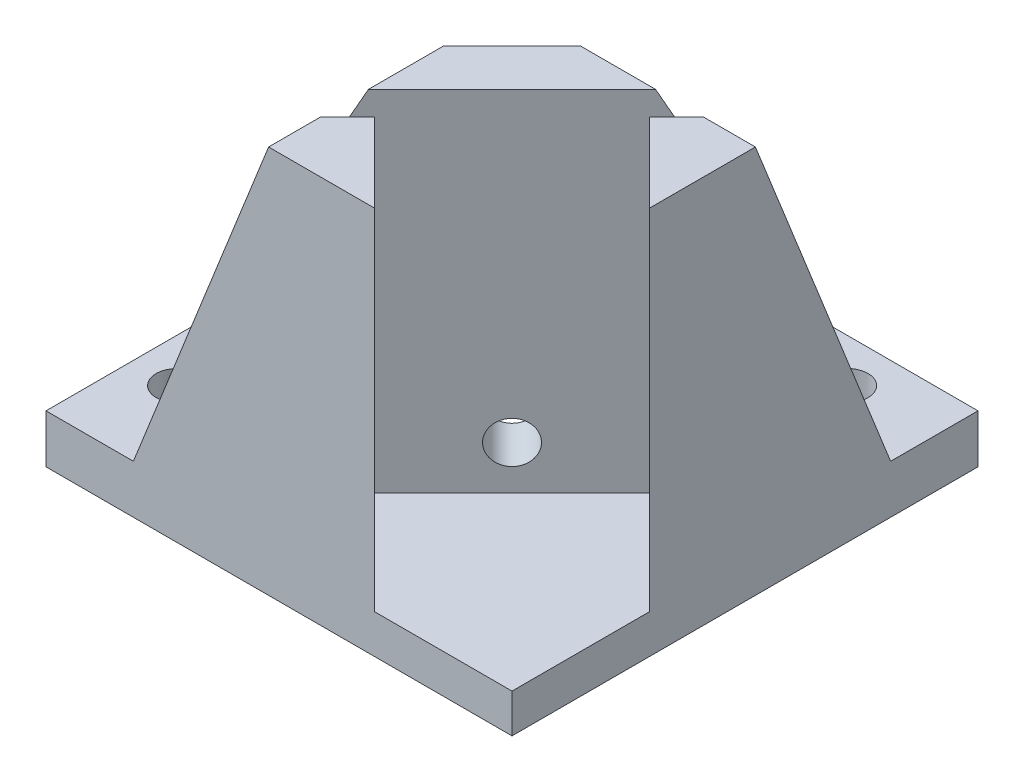
from build123d import *

# Parameters (mm, degrees)
SALIENTE_EXTRUIR1_DEPTH = 40
CORTAR_EXTRUIR4_DEPTH   = 36
SALIENTE_EXTRUIR2_DEPTH = 8.5
SALIENTE_EXTRUIR3_DEPTH = 40
CROQUIS5_R              = 2.15
CORTAR_EXTRUIR5_DEPTH   = 12
CORTAR_EXTRUIR7_DEPTH   = 30
CORTAR_EXTRUIR8_DEPTH   = 30
CROQUIS11_R             = 2.165
CORTAR_EXTRUIR9_DEPTH   = 30
CROQUIS12_R             = 2.15
CORTAR_EXTRUIR10_DEPTH  = 30


with BuildPart() as part:
    # Croquis2 → Saliente-Extruir1 (new body)
    with BuildSketch(Plane(origin=(0, 0, 0), x_dir=(1, 0, 0), z_dir=(0, 1, 0))):
        Polygon((0, 0), (48, 0), (48, 48), (30, 48), (30, 18), (0, 18), align=None)
    extrude(amount=SALIENTE_EXTRUIR1_DEPTH)

    # Croquis3 → Cortar-Extruir4 (cut)
    with BuildSketch(Plane(origin=(0, 40, 0), x_dir=(1, 0, 0), z_dir=(0, 1, 0))):
        Polygon((48, 14.142135624), (39.868272016, 22.273863607), (47.646446609, 30.0520382), (45.171572875, 32.526911935), (37.393398282, 24.748737342), (23.251262658, 10.606601718), (15.473088065, 2.828427125), (17.9479618, 0.353553391), (25.726136393, 8.131727984), (33.857864376, 0), (41.815185719, -7.957321343), (55.957321343, 6.184814281), align=None)
    extrude(amount=-CORTAR_EXTRUIR4_DEPTH, mode=Mode.SUBTRACT)

    # Croquis4 → Saliente-Extruir2 (add)
    with BuildSketch(Plane(origin=(0, 4, 0), x_dir=(1, 0, 0), z_dir=(0, 1, 0))):
        Polygon((39.868272016, 22.273863607), (37.393398282, 24.748737342), (45.171572875, 32.526911935), (47.646446609, 30.0520382), align=None)
        Polygon((15.473088065, 2.828427125), (17.9479618, 0.353553391), (25.726136393, 8.131727984), (23.251262658, 10.606601718), align=None)
    extrude(amount=SALIENTE_EXTRUIR2_DEPTH)

    # Croquis6 → Saliente-Extruir3 (add)
    with BuildSketch(Plane(origin=(0, 0, 0), x_dir=(1, 0, 0), z_dir=(0, 1, 0))):
        Polygon((30, 25.070901105), (22.929098895, 18), (30, 18), align=None)
    extrude(amount=SALIENTE_EXTRUIR3_DEPTH)

    # Croquis5 → Cortar-Extruir5 (cut)
    with BuildSketch(Plane(origin=(6.32233047, 0, 6.32233047), x_dir=(0.7071067811865472, 0, -0.7071067811865479), z_dir=(0.7071067811865479, 0, 0.7071067811865472))):
        with Locations((33.941125497, 8.5)):
            Circle(CROQUIS5_R)
    extrude(amount=-CORTAR_EXTRUIR5_DEPTH, mode=Mode.SUBTRACT)

    # Croquis9 → Cortar-Extruir7 (cut)
    with BuildSketch(Plane(origin=(0, 0, -18), x_dir=(-1, 0, 0), z_dir=(0, 0, -1))):
        Polygon((-22.929098895, 40), (-9, 5), (0, 5), (0, 40), align=None)
    extrude(amount=-CORTAR_EXTRUIR7_DEPTH, mode=Mode.SUBTRACT)

    # Croquis10 → Cortar-Extruir8 (cut)
    with BuildSketch(Plane.ZY.offset(-30)):
        Polygon((-25.070901105, 40), (-39, 5), (-48, 5), (-48, 40), align=None)
    extrude(amount=-CORTAR_EXTRUIR8_DEPTH, mode=Mode.SUBTRACT)

    # Croquis11 → Cortar-Extruir9 (cut)
    with BuildSketch(Plane(origin=(0, 5, 0), x_dir=(1, 0, 0), z_dir=(0, 1, 0))):
        with Locations((39, 43.5)):
            Circle(CROQUIS11_R)
    extrude(amount=-CORTAR_EXTRUIR9_DEPTH, mode=Mode.SUBTRACT)

    # Croquis12 → Cortar-Extruir10 (cut)
    with BuildSketch(Plane(origin=(0, 5, 0), x_dir=(1, 0, 0), z_dir=(0, 1, 0))):
        with Locations((4.5, 9)):
            Circle(CROQUIS12_R)
    extrude(amount=-CORTAR_EXTRUIR10_DEPTH, mode=Mode.SUBTRACT)


solid = part.part
